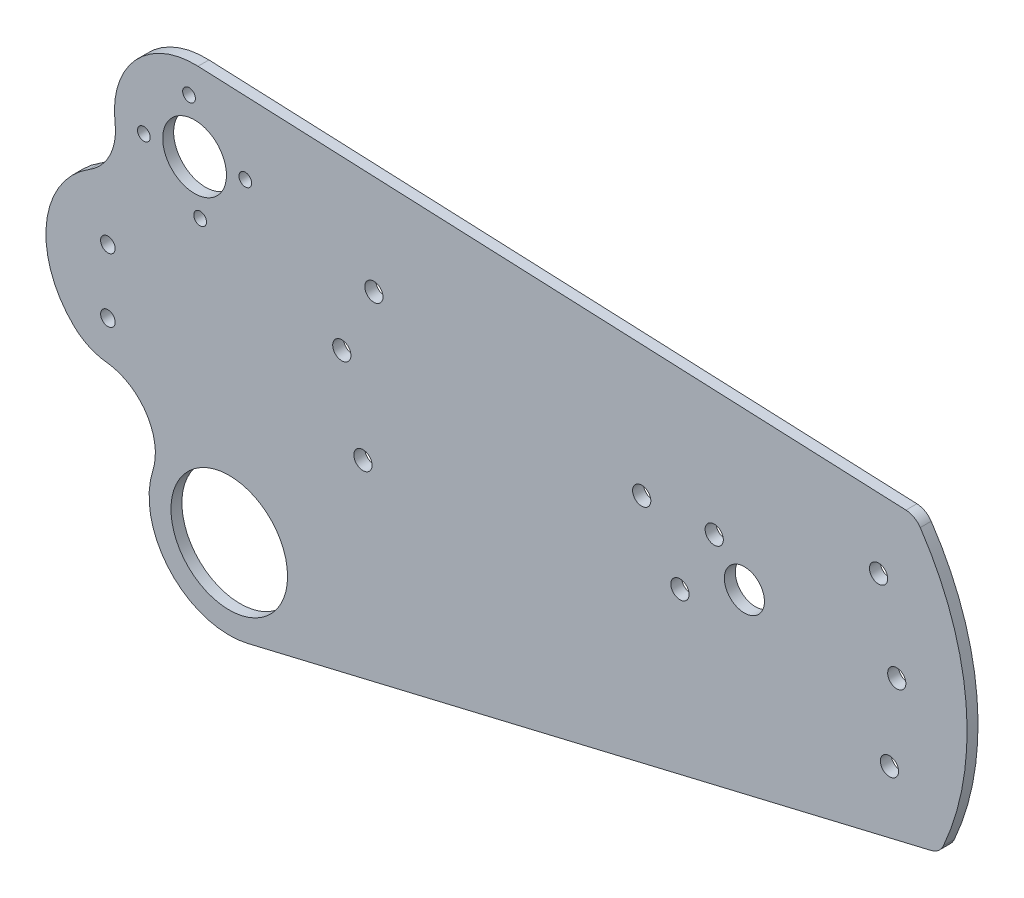
from build123d import *

# Parameters (mm, degrees)
SKETCH1_R           = 2
SKETCH1_R_2         = 2.5
SKETCH1_R_3         = 5.5
SKETCH1_R_4         = 1.75
SKETCH1_R_5         = 8.75
SKETCH1_R_6         = 16
BOSS_EXTRUDE1_DEPTH = 3


with BuildPart() as part:
    # Sketch1 → Boss-Extrude1 (new body)
    with BuildSketch(Plane.XY):
        with BuildLine():
            ThreePointArc((-113.560266524, 49.479735972), (-130.694234864, 42.395842918), (-136.329525131, 24.732380193))
            ThreePointArc((-136.329525131, 24.732380193), (-137.686520221, 16.356467092), (-143.370984404, 10.056925608))
            ThreePointArc((-143.370984404, 10.056925608), (-155.166532009, -8.626129333), (-147.542861296, -29.364285714))
            ThreePointArc((-147.542861296, -29.364285714), (-143.475887893, -32.124161339), (-138.735140925, -33.421275181))
            ThreePointArc((-138.735140925, -33.421275181), (-127.733357788, -40.106373668), (-125.965715234, -52.858048609))
            ThreePointArc((-125.965715234, -52.858048609), (-121.095745986, -74.463536322), (-99.899442585, -80.88462828))
            Line((-99.899442585, -80.88462828), (87.590338172, -36.326384859))
            ThreePointArc((87.590338172, -36.326384859), (89.625170423, -35.311295666), (91, -33.5))
            ThreePointArc((91, -33.5), (97.213976906, 3.543991621), (84.648444567, 38.941424032))
            ThreePointArc((84.648444567, 38.941424032), (82.945648013, 40.504860181), (80.721588123, 41.135261877))
            Line((80.721588123, 41.135261877), (-113.560266524, 49.479735972))
        make_face()
        with Locations((-138.3, -22.75)):
            Circle(SKETCH1_R, mode=Mode.SUBTRACT)
        with Locations((-68.3, -21.5)):
            Circle(SKETCH1_R_2, mode=Mode.SUBTRACT)
        with Locations((-138.3, -5.25)):
            Circle(SKETCH1_R, mode=Mode.SUBTRACT)
        with Locations((-74.1, 1.7)):
            Circle(SKETCH1_R_2, mode=Mode.SUBTRACT)
        with Locations((18.7, -8.7)):
            Circle(SKETCH1_R_2, mode=Mode.SUBTRACT)
        with Locations((76.2, -22)):
            Circle(SKETCH1_R_2, mode=Mode.SUBTRACT)
        with Locations((8.2, 8.3)):
            Circle(SKETCH1_R_2, mode=Mode.SUBTRACT)
        with Locations((36.382449965, 0)):
            Circle(SKETCH1_R_3, mode=Mode.SUBTRACT)
        with Locations((78.2, -0.1)):
            Circle(SKETCH1_R_2, mode=Mode.SUBTRACT)
        with Locations((28.1, 9)):
            Circle(SKETCH1_R_2, mode=Mode.SUBTRACT)
        with Locations((-112.981409671, 13.583075301)):
            Circle(SKETCH1_R_4, mode=Mode.SUBTRACT)
        with Locations((-128.421228626, 25.977105744)):
            Circle(SKETCH1_R_4, mode=Mode.SUBTRACT)
        with Locations((-65.3, 20)):
            Circle(SKETCH1_R_2, mode=Mode.SUBTRACT)
        with Locations((-114.504303927, 27.5)):
            Circle(SKETCH1_R_5, mode=Mode.SUBTRACT)
        with Locations((-100.587379227, 29.022894256)):
            Circle(SKETCH1_R_4, mode=Mode.SUBTRACT)
        with Locations((-116.027198182, 41.416924699)):
            Circle(SKETCH1_R_4, mode=Mode.SUBTRACT)
        with Locations((73.2, 22.3)):
            Circle(SKETCH1_R_2, mode=Mode.SUBTRACT)
        with Locations((-104.986214828, -59.480779371)):
            Circle(SKETCH1_R_6, mode=Mode.SUBTRACT)
    extrude(amount=BOSS_EXTRUDE1_DEPTH)


solid = part.part
